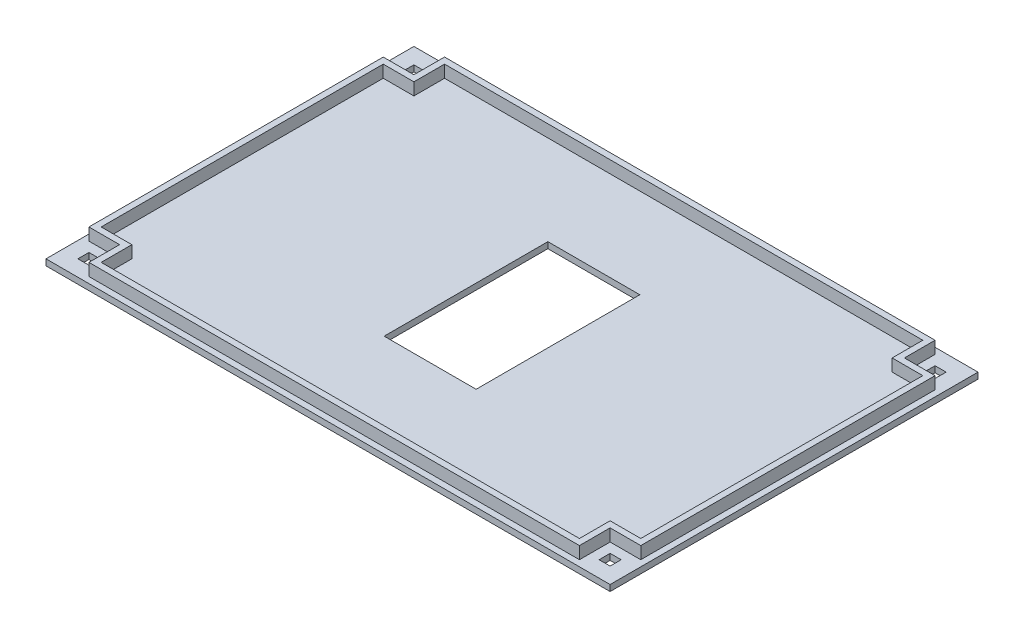
from build123d import *

# Parameters (mm, degrees)
SKETCH_1_W          = 92
SKETCH_1_H          = 60
EXTRUDE_1_DEPTH     = 1
EXTRUDE_3_DEPTH     = 2
SKETCH_6_W          = 1.8
SKETCH_6_H          = 1.8
CUT_EXTRUDE_3_DEPTH = 1
SKETCH_7_W          = 1.8
SKETCH_7_H          = 1.8
CUT_EXTRUDE_4_DEPTH = 1
SKETCH_8_W          = 1.8
SKETCH_8_H          = 1.8
CUT_EXTRUDE_5_DEPTH = 1
SKETCH_9_W          = 1.8
SKETCH_9_H          = 1.8
CUT_EXTRUDE_6_DEPTH = 1
SKETCH_15_W         = 15
SKETCH_15_H         = 26.7
CUT_EXTRUDE_8_DEPTH = 1


with BuildPart() as part:
    # Эскиз1 → Бобышка-Вытянуть1 (new body)
    with BuildSketch(Plane(origin=(0, 0, 0), x_dir=(1, 0, 0), z_dir=(0, 1, 0))):
        with Locations((46, 30)):
            Rectangle(SKETCH_1_W, SKETCH_1_H)
    extrude(amount=EXTRUDE_1_DEPTH)

    # Эскиз3 → Бобышка-Вытянуть3 (add)
    with BuildSketch(Plane(origin=(0, 1, 0), x_dir=(1, 0, 0), z_dir=(0, 1, 0))):
        Polygon((86, 54), (91, 54), (91, 6), (86, 6), (86, 1), (6, 1), (6, 6), (1, 6), (1, 54), (6, 54), (6, 59), (86, 59), align=None)
        Polygon((7, 58), (7, 53), (2, 53), (2, 7), (7, 7), (7, 2), (85, 2), (85, 7), (90, 7), (90, 53), (85, 53), (85, 58), align=None, mode=Mode.SUBTRACT)
    extrude(amount=EXTRUDE_3_DEPTH)

    # Эскиз6 → Вырез-Вытянуть3 (cut)
    with BuildSketch(Plane(origin=(0, 1, 0), x_dir=(1, 0, 0), z_dir=(0, 1, 0))):
        with Locations((3.5, 56.5)):
            Rectangle(SKETCH_6_W, SKETCH_6_H)
    extrude(amount=-CUT_EXTRUDE_3_DEPTH, mode=Mode.SUBTRACT)

    # Эскиз7 → Вырез-Вытянуть4 (cut)
    with BuildSketch(Plane(origin=(0, 1, 0), x_dir=(1, 0, 0), z_dir=(0, 1, 0))):
        with Locations((88.5, 56.5)):
            Rectangle(SKETCH_7_W, SKETCH_7_H)
    extrude(amount=-CUT_EXTRUDE_4_DEPTH, mode=Mode.SUBTRACT)

    # Эскиз8 → Вырез-Вытянуть5 (cut)
    with BuildSketch(Plane(origin=(0, 1, 0), x_dir=(1, 0, 0), z_dir=(0, 1, 0))):
        with Locations((88.5, 3.5)):
            Rectangle(SKETCH_8_W, SKETCH_8_H)
    extrude(amount=-CUT_EXTRUDE_5_DEPTH, mode=Mode.SUBTRACT)

    # Эскиз9 → Вырез-Вытянуть6 (cut)
    with BuildSketch(Plane(origin=(0, 1, 0), x_dir=(1, 0, 0), z_dir=(0, 1, 0))):
        with Locations((3.5, 3.5)):
            Rectangle(SKETCH_9_W, SKETCH_9_H)
    extrude(amount=-CUT_EXTRUDE_6_DEPTH, mode=Mode.SUBTRACT)

    # Эскиз15 → Вырез-Вытянуть8 (cut)
    with BuildSketch(Plane(origin=(0, 1, 0), x_dir=(1, 0, 0), z_dir=(0, 1, 0))):
        with Locations((46, 30)):
            Rectangle(SKETCH_15_W, SKETCH_15_H)
    extrude(amount=-CUT_EXTRUDE_8_DEPTH, mode=Mode.SUBTRACT)


solid = part.part
